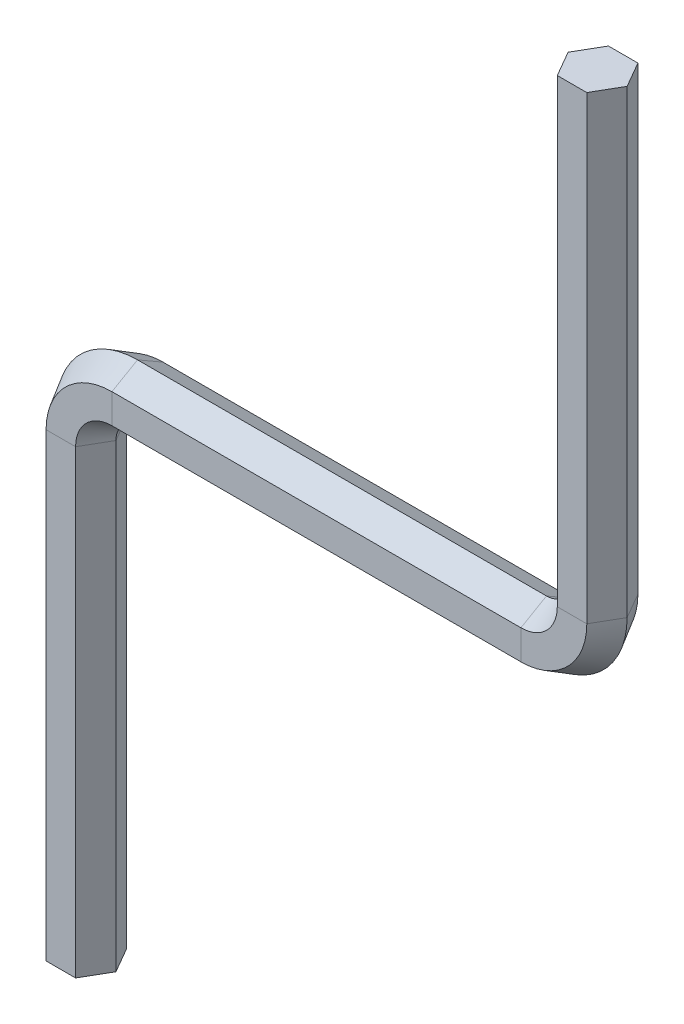
from build123d import *


with BuildPart() as part:
    # Sweep5: sweep along a path in Sketch1
    with BuildLine(Plane.XY) as sweep5_path:
        Line((0, 0), (0, 450))
        ThreePointArc((0, 450), (14.644660941, 485.355339059), (50, 500))
        Line((50, 500), (450, 500))
        ThreePointArc((450, 500), (485.355339059, 514.644660941), (500, 550))
        Line((500, 550), (500, 1000))
    # Sketch12 → Sweep5 (sweep)
    with BuildSketch(Plane(origin=(0, 0, 0), x_dir=(1, 0, 0), z_dir=(0, 1, 0))):
        Polygon((-14.43375673, -25), (14.43375673, -25), (28.867513459, 0), (14.43375673, 25), (-14.43375673, 25), (-28.867513459, 0), align=None)
    sweep(path=sweep5_path.line)


solid = part.part
